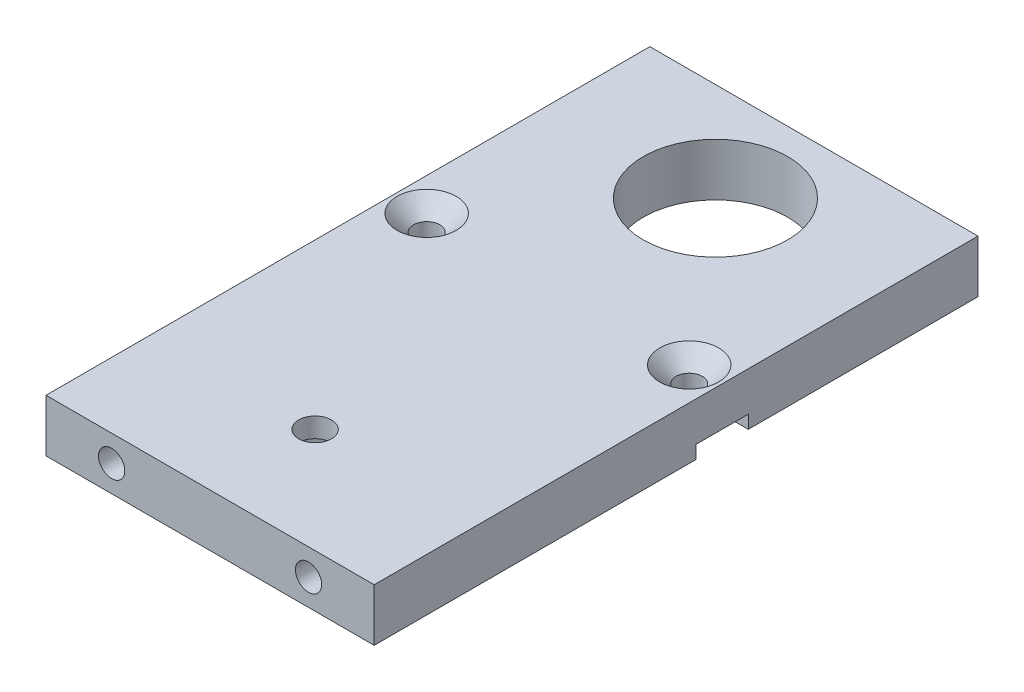
from build123d import *

# Parameters (mm, degrees)
ESQUISSE1_W             = 50
ESQUISSE1_H             = 92
ESQUISSE1_R             = 11
ESQUISSE1_R_2           = 2
BOSS_EXTRU_1_DEPTH      = 8
CHANFREIN1_SIZE         = 2.5
ESQUISSE2_R             = 2
ENL_V_MAT_EXTRU_1_DEPTH = 10
ESQUISSE3_R             = 8
ENL_V_MAT_EXTRU_2_DEPTH = 5
ESQUISSE4_R             = 2.5
ENL_V_MAT_EXTRU_3_DEPTH = 79.852413099
ESQUISSE5_W             = 50
ESQUISSE5_H             = 8
ENL_V_MAT_EXTRU_4_DEPTH = 2


with BuildPart() as part:
    # Esquisse1 → Boss.-Extru.1 (new body)
    with BuildSketch(Plane(origin=(0, 0, 0), x_dir=(1, 0, 0), z_dir=(0, 1, 0))):
        with Locations((-6.491408935, -26.117918819)):
            Rectangle(ESQUISSE1_W, ESQUISSE1_H)
        with Locations(Location((-6.491408935, 4.882081181, 0), (0, 0, 270))):
            Circle(ESQUISSE1_R, mode=Mode.SUBTRACT)
        with Locations(Location((-26.491408935, -19.117918819, 0), (0, 0, 270))):
            Circle(ESQUISSE1_R_2, mode=Mode.SUBTRACT)
        with Locations(Location((13.508591065, -19.117918819, 0), (0, 0, 270))):
            Circle(ESQUISSE1_R_2, mode=Mode.SUBTRACT)
    extrude(amount=BOSS_EXTRU_1_DEPTH)

    # Chanfrein1
    chanfrein1_edges = [part.edges().sort_by_distance(p)[0] for p in [
        (-26.491408935, 8, 17.117918819),
        (13.508591065, 8, 17.117918819),
    ]]
    chamfer(chanfrein1_edges, length=CHANFREIN1_SIZE)

    # Esquisse2 → Enlèv. mat.-Extru.1 (cut)
    with BuildSketch(Plane.XY.offset(72.117918819)):
        with Locations((-21.491408935, 4)):
            Circle(ESQUISSE2_R)
        with Locations((8.508591065, 4)):
            Circle(ESQUISSE2_R)
    extrude(amount=-ENL_V_MAT_EXTRU_1_DEPTH, mode=Mode.SUBTRACT)

    # Esquisse3 → Enlèv. mat.-Extru.2 (cut)
    with BuildSketch(Plane.XZ):
        with Locations(Location((-6.491408935, 56.117918819, 0), (0, 0, 270))):
            Circle(ESQUISSE3_R)
    extrude(amount=-ENL_V_MAT_EXTRU_2_DEPTH, mode=Mode.SUBTRACT)

    # Esquisse4 → Enlèv. mat.-Extru.3 (cut, through all)
    with BuildSketch(Plane.XZ.offset(-5)):
        with Locations(Location((-6.491408935, 56.117918819, 0), (0, 0, 270))):
            Circle(ESQUISSE4_R)
    extrude(amount=-ENL_V_MAT_EXTRU_3_DEPTH, mode=Mode.SUBTRACT)

    # Esquisse5 → Enlèv. mat.-Extru.4 (cut)
    with BuildSketch(Plane.XZ):
        with Locations((-6.491408935, 19.117918819)):
            Rectangle(ESQUISSE5_W, ESQUISSE5_H)
    extrude(amount=-ENL_V_MAT_EXTRU_4_DEPTH, mode=Mode.SUBTRACT)


solid = part.part
